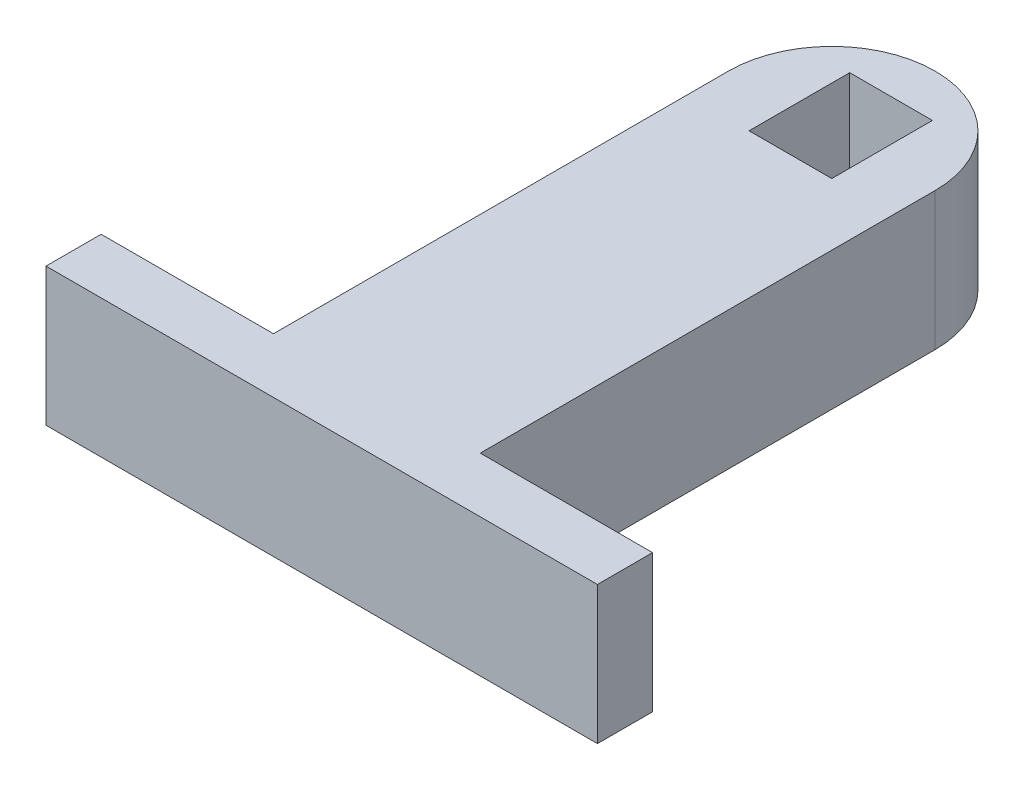
from build123d import *

# Parameters (mm, degrees)
CROQUIS2_R              = 75
CROQUIS2_R_2            = 25
CROQUIS2_W              = 400
CROQUIS2_H              = 40
SALIENTE_EXTRUIR1_DEPTH = 100
CROQUIS3_W              = 60
CROQUIS3_H              = 73
CORTAR_EXTRUIR1_DEPTH   = 107


with BuildPart() as part:
    # Croquis2 → Saliente-Extruir1 (new body)
    # profile 1 of 3: a face of its own
    with BuildSketch(Plane(origin=(0, 0, 0), x_dir=(1, 0, 0), z_dir=(0, 1, 0))):
        with Locations((-200, 370)):
            Circle(CROQUIS2_R)
        with Locations(Location((-200, 370, 0), (0, 0, 270))):
            Circle(CROQUIS2_R_2, mode=Mode.SUBTRACT)
    # profile 2 of 3: a face of its own
    with BuildSketch(Plane(origin=(0, 0, 0), x_dir=(1, 0, 0), z_dir=(0, 1, 0))):
        with BuildLine():
            Line((-275, 345), (-275, 40))
            Line((-275, 40), (-200, 40))
            Line((-200, 40), (-125, 40))
            Line((-125, 40), (-125, 345))
            Line((-125, 345), (-125, 370))
            ThreePointArc((-125, 370), (-200, 295), (-275, 370))
            Line((-275, 370), (-275, 345))
        make_face()
    # profile 3 of 3: a face of its own
    with BuildSketch(Plane(origin=(0, 0, 0), x_dir=(1, 0, 0), z_dir=(0, 1, 0))):
        with Locations((-200, 20)):
            Rectangle(CROQUIS2_W, CROQUIS2_H)
    extrude(amount=SALIENTE_EXTRUIR1_DEPTH)

    # Croquis3 → Cortar-Extruir1 (cut)
    with BuildSketch(Plane.XZ):
        with Locations((-200, -376.5)):
            Rectangle(CROQUIS3_W, CROQUIS3_H)
    extrude(amount=-CORTAR_EXTRUIR1_DEPTH, mode=Mode.SUBTRACT)


solid = part.part
